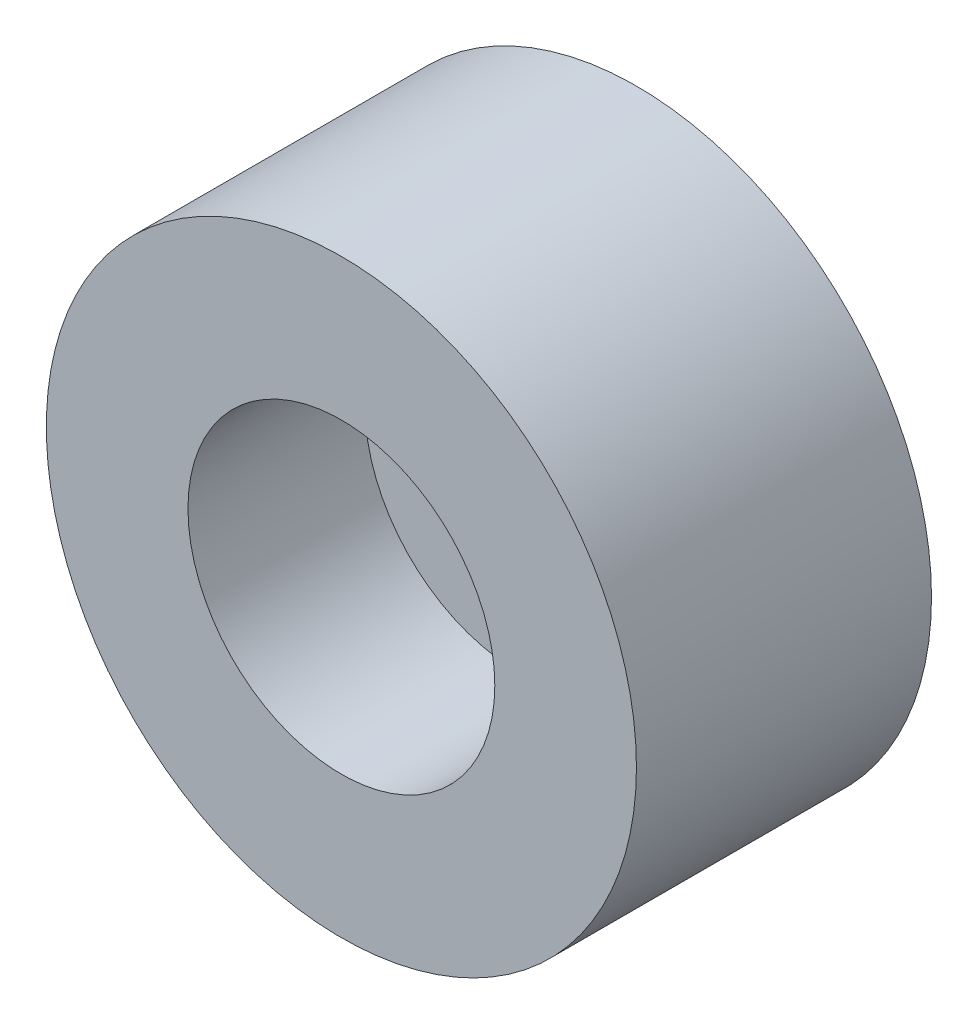
from build123d import *

# Parameters (mm, degrees)
SKETCH1_R           = 12.7
SKETCH1_R_2         = 6.604
BOSS_EXTRUDE1_DEPTH = 12.7
SKETCH1_2_R         = 6.604
BOSS_EXTRUDE2_DEPTH = 5.08


with BuildPart() as part:
    # Sketch1 → Boss-Extrude1 (new body)
    with BuildSketch(Plane.XY):
        Circle(SKETCH1_R)
        Circle(SKETCH1_R_2, mode=Mode.SUBTRACT)
    extrude(amount=BOSS_EXTRUDE1_DEPTH)

    # Sketch1<2> → Boss-Extrude2 (add)
    with BuildSketch(Plane.XY):
        Circle(SKETCH1_2_R)
    extrude(amount=BOSS_EXTRUDE2_DEPTH)


solid = part.part
